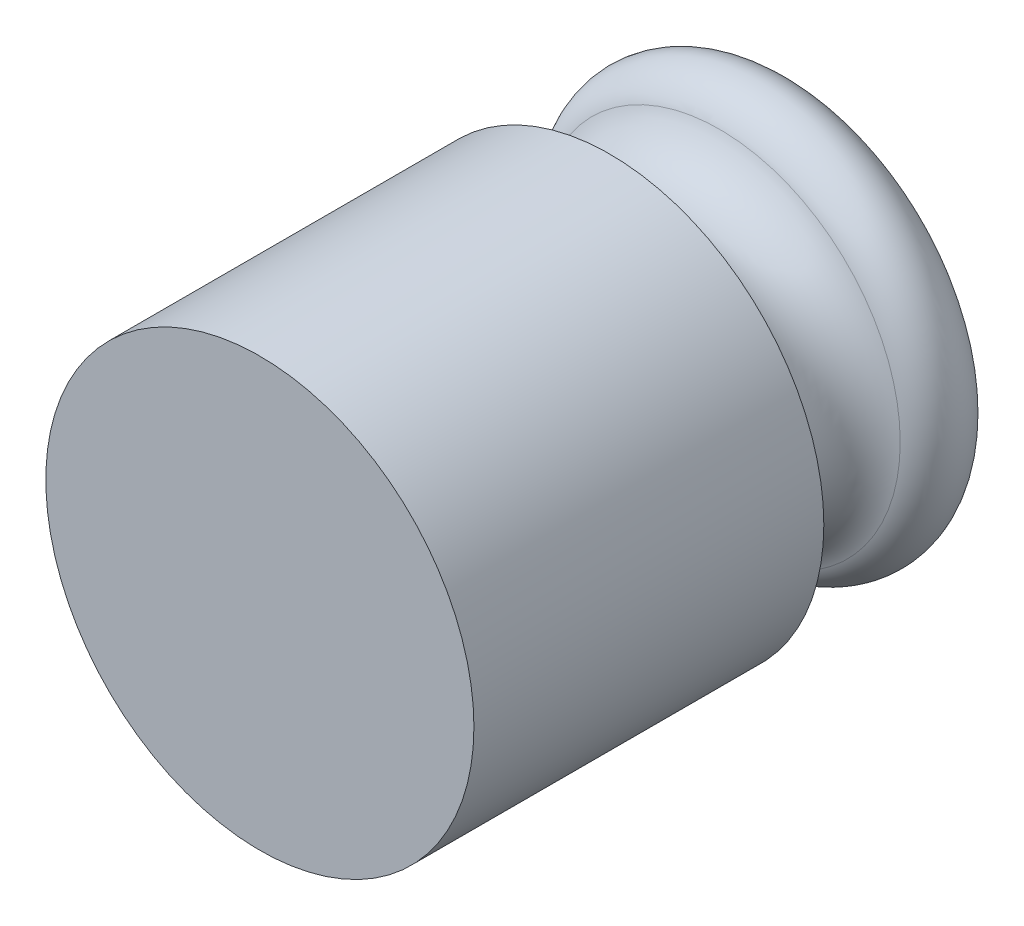
from build123d import *

# Parameters (mm, degrees)
SKETCH1_R           = 15.6
BOSS_EXTRUDE1_DEPTH = 12.75


with BuildPart() as part:
    # Sketch1 → Boss-Extrude1 (new, symmetric)
    with BuildSketch(Plane.XY):
        Circle(SKETCH1_R)
    extrude(amount=BOSS_EXTRUDE1_DEPTH, both=True)

    # Sketch2 → Revolve1 (revolve)
    with BuildSketch(Plane(origin=(0, 0, 0), x_dir=(0, 0, -1), z_dir=(1, 0, 0)), mode=Mode.PRIVATE) as revolve1_sk:
        with BuildLine():
            Line((12.75, 0), (20.75, 0))
            Line((20.75, 0), (26.25, 0))
            Line((26.25, 0), (26.25, 12.157397862))
            ThreePointArc((26.25, 12.157397862), (23.920458322, 14.953315579), (20.75, 13.166666667))
            ThreePointArc((20.75, 13.166666667), (16.138424259, 10.567904613), (12.75, 14.634694019))
            Line((12.75, 14.634694019), (12.75, 0))
        make_face()
    revolve(revolve1_sk.sketch.rotate(Axis((0, 0, -12.75), (0, 0, -1)), 90), axis=Axis((0, 0, -12.75), (0, 0, -1)))


solid = part.part
